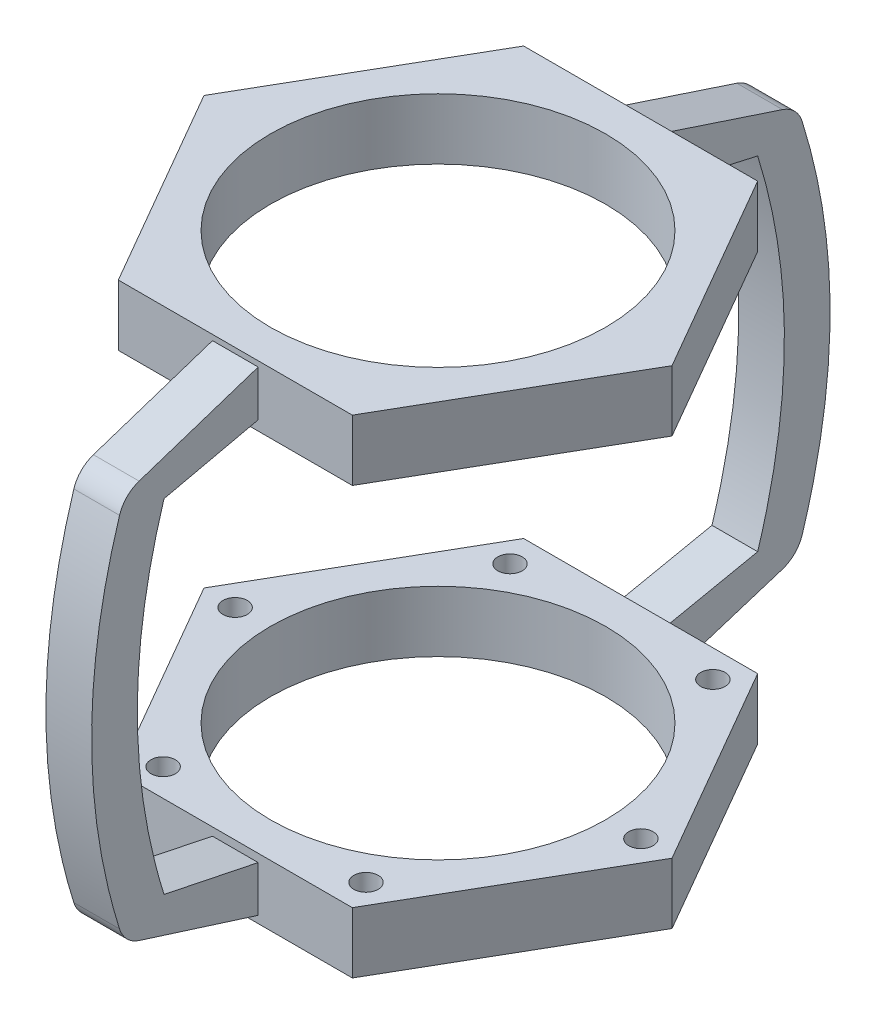
from build123d import *

# Parameters (mm, degrees)
SKETCH_1_R               = 55.01
EXTRUDE_1_DEPTH          = 20
FILLET_2_R               = 10
FILLET_3_R               = 10
SKETCH_19_R              = 4
CUT_EXTRUDE_2_DEPTH      = 20
PATTERN_CIRCULAR_2_COUNT = 6


with BuildPart() as part:
    # 草图1 → 凸台-拉伸1 (new body)
    with BuildSketch(Plane(origin=(0, 0, 0), x_dir=(1, 0, 0), z_dir=(0, 1, 0))):
        Polygon((76.810292696, 0), (38.405146348, 66.519664747), (-38.405146348, 66.519664747), (-76.810292696, 0), (-38.405146348, -66.519664747), (38.405146348, -66.519664747), align=None)
        with Locations(Location((0, 0, 0), (0, 0, 270))):
            Circle(SKETCH_1_R, mode=Mode.SUBTRACT)
    extrude(amount=EXTRUDE_1_DEPTH)


with BuildPart() as body_2:
    # 镜向5: mirrored copy
    add(part.part.mirror(Plane.ZX.offset(80)))


with BuildPart() as body_3:
    # 草图9 → 放样1 section 0
    with BuildSketch(Plane(origin=(0, 60, -34.641016151), x_dir=(0, 0.4999999999999954, 0.8660254037844413), z_dir=(0, 0.8660254037844413, -0.4999999999999954))):
        with BuildLine():
            Line((152.5, 7.5), (167.5, 7.5))
            Line((167.5, 7.5), (167.5, -7.5))
            Line((167.5, -7.5), (152.5, -7.5))
            Line((152.5, -7.5), (152.5, 7.5))
        make_face()
    # 草图11 → 放样1 section 1
    with BuildSketch(Plane(origin=(0, 80, 0), x_dir=(1, 0, 0), z_dir=(0, 1, 0))):
        with BuildLine():
            Line((-7.5, -106.192314052), (7.5, -106.192314052))
            Line((7.5, -106.192314052), (7.5, -121.192314052))
            Line((7.5, -121.192314052), (-7.5, -121.192314052))
            Line((-7.5, -121.192314052), (-7.5, -106.192314052))
        make_face()
    # 草图10 → 放样1 section 2
    with BuildSketch(Plane(origin=(0, 60, 34.641016151), x_dir=(0, -0.4999999999999958, 0.8660254037844412), z_dir=(0, 0.866025403784441, 0.4999999999999957))):
        with BuildLine():
            Line((72.5, 7.5), (87.5, 7.5))
            Line((87.5, 7.5), (87.5, -7.5))
            Line((87.5, -7.5), (72.5, -7.5))
            Line((72.5, -7.5), (72.5, 7.5))
        make_face()
    loft()

    # 草图16 → section 0 of loft_3
    with BuildSketch(Plane.XY.offset(66.52), mode=Mode.PRIVATE) as loft_3_s0:
        with BuildLine():
            Line((-7.5, 158.220398546), (7.5, 158.220398546))
            Line((7.5, 158.220398546), (7.5, 143.220398546))
            Line((7.5, 143.220398546), (-7.5, 143.220398546))
            Line((-7.5, 143.220398546), (-7.5, 158.220398546))
        make_face()
    # loft up to a face of the part (loft_3)
    loft([loft_3_s0.sketch, body_3.faces().sort_by_distance((0, 140, 103.923048454))[0]])

    # 草图18 → section 0 of loft_6
    with BuildSketch(Plane.XY.offset(66.52), mode=Mode.PRIVATE) as loft_6_s0:
        with BuildLine():
            Line((-7.5, 17.362272827), (7.5, 17.362272827))
            Line((7.5, 17.362272827), (7.5, 2.362272827))
            Line((7.5, 2.362272827), (-7.5, 2.362272827))
            Line((-7.5, 2.362272827), (-7.5, 17.362272827))
        make_face()
    # loft up to a face of the part (loft_6)
    loft([loft_6_s0.sketch, body_3.faces().sort_by_distance((0, 20, 103.923048454))[0]])

    # 圆角2
    fillet_2_edges = [body_3.edges().sort_by_distance(p)[0] for p in [
        (0, 143.75, 110.418238983),
    ]]
    fillet(fillet_2_edges, radius=FILLET_2_R)

    # 圆角3
    fillet_3_edges = [body_3.edges().sort_by_distance(p)[0] for p in [
        (0, 16.25, 110.418238983),
    ]]
    fillet(fillet_3_edges, radius=FILLET_3_R)


with BuildPart() as body_4:
    # 镜向6: mirrored copy
    add(body_3.part.mirror(Plane.XY))


with BuildPart() as part_1:
    add(part.part)

    # 草图19 → 切除-拉伸2 (cut)
    with BuildSketch(Plane.XZ):
        with Locations(Location((33.456884152, 57.079861104, 0), (0, 0, 270))):
            Circle(SKETCH_19_R)
    cut_extrude_2 = extrude(amount=-CUT_EXTRUDE_2_DEPTH, mode=Mode.SUBTRACT)

    # 阵列(圆周)2: 切除-拉伸2 ×6 about axis
    pattern_circular_2_axis = Axis((0, 0, 0), (0, 1, 0))
    for i in range(1, PATTERN_CIRCULAR_2_COUNT):
        add(cut_extrude_2.rotate(pattern_circular_2_axis, i * 360 / PATTERN_CIRCULAR_2_COUNT), mode=Mode.SUBTRACT)


solid = Compound([body_2.part, body_3.part, body_4.part, part_1.part])
